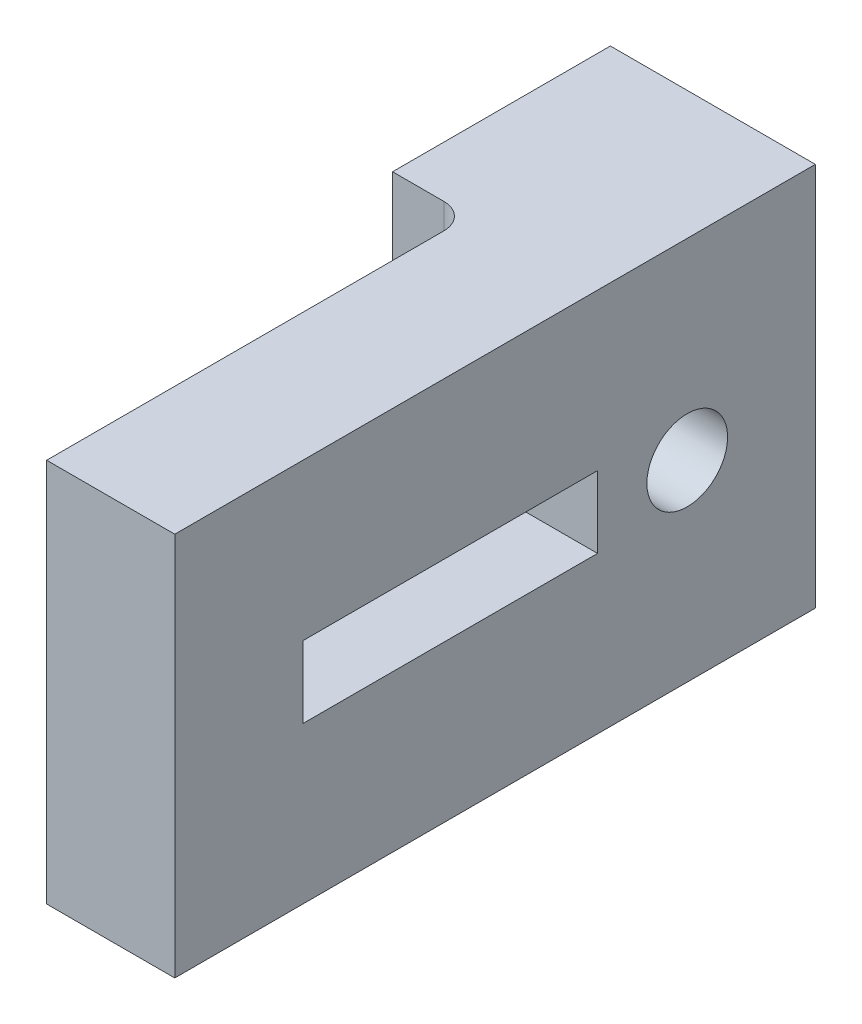
from build123d import *

# Parameters (mm, degrees)
EXTRUDE_1_DEPTH     = 15
CUT_EXTRUDE_1_DEPTH = 15
FILLET_1_R          = 1
SKETCH_3_W          = 11.5
SKETCH_3_H          = 1.4
CUT_EXTRUDE_2_DEPTH = 10


with BuildPart() as part:
    # 草图1 → 凸台-拉伸1 (new body)
    with BuildSketch(Plane(origin=(0, 0, 0), x_dir=(1, 0, 0), z_dir=(0, 1, 0))):
        Polygon((-5.74789916, 13.058823529), (2.25210084, 13.058823529), (2.25210084, -11.941176471), (-2.74789916, -11.941176471), (-2.74789916, 4.558823529), (-5.74789916, 4.558823529), align=None)
    extrude(amount=EXTRUDE_1_DEPTH)

    # 草图2 → 切除-拉伸1 (cut)
    with BuildSketch(Plane.ZY.offset(5.74789916)):
        with BuildLine():
            ThreePointArc((-6.483823529, 7.5), (-8.058823529, 9.075), (-9.633823529, 7.5))
            Line((-9.633823529, 7.5), (-6.483823529, 7.5))
        make_face()
        with BuildLine():
            Line((-6.483823529, 7.5), (-9.633823529, 7.5))
            ThreePointArc((-9.633823529, 7.5), (-8.058823529, 5.925), (-6.483823529, 7.5))
        make_face()
    extrude(amount=-CUT_EXTRUDE_1_DEPTH, mode=Mode.SUBTRACT)

    # 圆角1
    fillet_1_edges = [part.edges().sort_by_distance(p)[0] for p in [
        (-2.74789916, 7.5, -4.558823529),
    ]]
    fillet(fillet_1_edges, radius=FILLET_1_R)

    # 草图3 → 切除-拉伸2 (cut)
    with BuildSketch(Plane.ZY.offset(2.74789916)):
        with Locations((1.191176471, 8.2)):
            Rectangle(SKETCH_3_W, SKETCH_3_H)
        with Locations((1.191176471, 6.8)):
            Rectangle(SKETCH_3_W, SKETCH_3_H)
    extrude(amount=-CUT_EXTRUDE_2_DEPTH, mode=Mode.SUBTRACT)


solid = part.part
